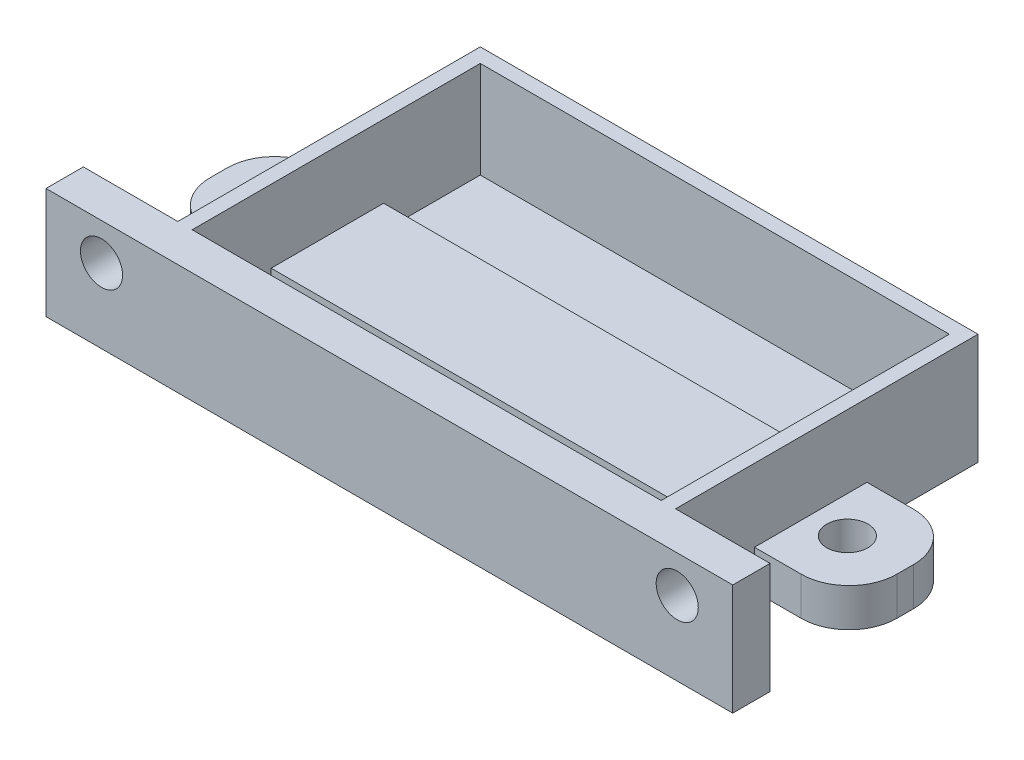
from build123d import *

# Parameters (mm, degrees)
SKETCH1_W           = 52
SKETCH1_H           = 35.5
BOSS_EXTRUDE1_DEPTH = 11.6
SHELL1_T            = -1.5
SKETCH2_W           = 71.75
SKETCH2_H           = 11.6
BOSS_EXTRUDE2_DEPTH = 3.9
SKETCH3_W           = 71.75
SKETCH3_H           = 11.75
BOSS_EXTRUDE3_DEPTH = 4
FILLET1_R           = 5
SKETCH4_R           = 2.15
CUT_EXTRUDE1_DEPTH  = 41.741110994
SKETCH5_R           = 2.2
CUT_EXTRUDE2_DEPTH  = 52.786345932


with BuildPart() as part:
    # Sketch1 → Boss-Extrude1 (new body)
    with BuildSketch(Plane(origin=(0, 0, 0), x_dir=(1, 0, 0), z_dir=(0, 1, 0))):
        Rectangle(SKETCH1_W, SKETCH1_H)
    extrude(amount=BOSS_EXTRUDE1_DEPTH)

    # Shell1
    shell1_openings = [part.faces().sort_by_distance(p)[0] for p in [
        (0, 11.6, 0),
    ]]
    offset(amount=SHELL1_T, openings=shell1_openings, kind=Kind.INTERSECTION)

    # Sketch2 → Boss-Extrude2 (add)
    with BuildSketch(Plane.XY.offset(17.75)):
        with Locations((0, 5.8)):
            Rectangle(SKETCH2_W, SKETCH2_H)
    extrude(amount=-BOSS_EXTRUDE2_DEPTH)

    # Sketch3 → Boss-Extrude3 (add)
    with BuildSketch(Plane.XZ):
        with Locations((0, -0.275)):
            Rectangle(SKETCH3_W, SKETCH3_H)
    extrude(amount=-BOSS_EXTRUDE3_DEPTH)

    # Fillet1
    fillet1_edges = [part.edges().sort_by_distance(p)[0] for p in [
        (-35.875, 2, 5.6),
        (35.875, 2, -6.15),
        (-35.875, 2, -6.15),
        (35.875, 2, 5.6),
    ]]
    fillet(fillet1_edges, radius=FILLET1_R)

    # Sketch4 → Cut-Extrude1 (cut, through all)
    with BuildSketch(Plane(origin=(0, 4, 0), x_dir=(1, 0, 0), z_dir=(0, 1, 0))):
        with Locations(Location((-29.825, 0.275, 0), (0, 0, 270))):
            Circle(SKETCH4_R)
        with Locations(Location((29.825, 0.275, 0), (0, 0, 270))):
            Circle(SKETCH4_R)
    extrude(amount=-CUT_EXTRUDE1_DEPTH, mode=Mode.SUBTRACT)

    # Sketch5 → Cut-Extrude2 (cut, through all)
    with BuildSketch(Plane.XY.offset(17.75)):
        with Locations((-30.075, 7.75)):
            Circle(SKETCH5_R)
        with Locations((30.075, 7.75)):
            Circle(SKETCH5_R)
    extrude(amount=-CUT_EXTRUDE2_DEPTH, mode=Mode.SUBTRACT)


solid = part.part
